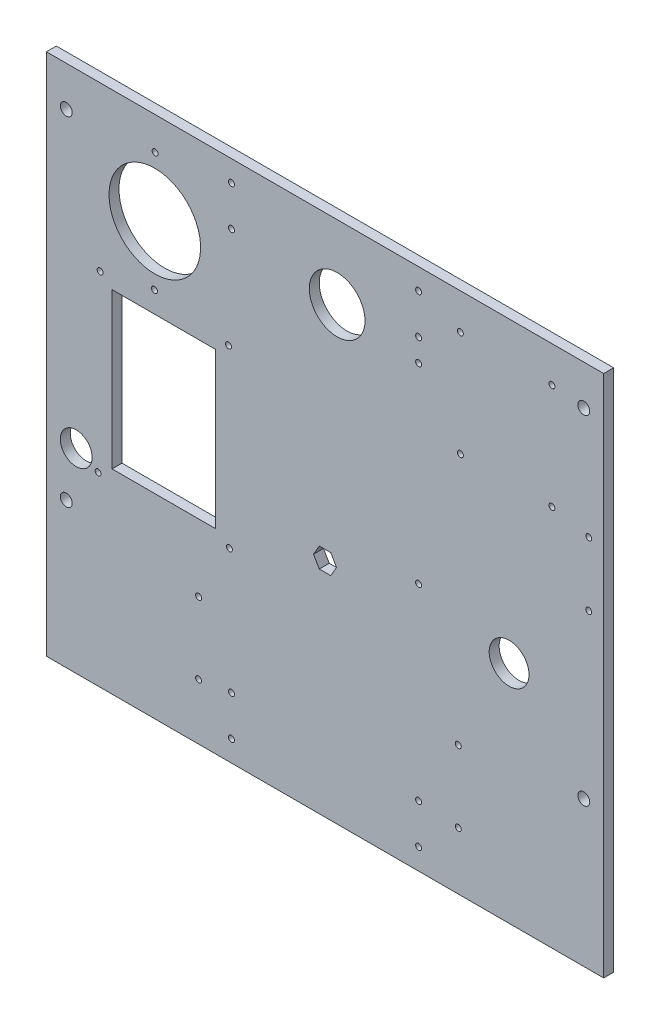
from build123d import *

# Parameters (mm, degrees)
ESQUISSE1_W              = 280
ESQUISSE1_H              = 210
BOSS_EXTRU_1_DEPTH       = 5
ESQUISSE2_R              = 3
ESQUISSE2_R_2            = 1.5
ESQUISSE2_R_3            = 8
ESQUISSE2_R_4            = 14
ESQUISSE2_R_5            = 10
ESQUISSE2_W              = 52
ESQUISSE2_H              = 78
ENL_V_MAT_EXTRU_1_DEPTH  = 351.035712464
ESQUISSE5_R              = 1.5
ENL_V_MAT_EXTRU_3_DEPTH  = 351.035712464
ESQUISSE6_W              = 280
ESQUISSE6_H              = 53
BOSS_EXTRU_4_DEPTH       = 5
ESQUISSE7_R              = 1.5
ENL_V_MAT_EXTRU_4_DEPTH  = 351.035712464
ESQUISSE8_R              = 1.5
ENL_V_MAT_EXTRU_5_DEPTH  = 351.035712464
ESQUISSE9_R              = 1.5
ENL_V_MAT_EXTRU_6_DEPTH  = 351.035712464
ESQUISSE14_R             = 23
ESQUISSE14_R_2           = 1.5
ENL_V_MAT_EXTRU_11_DEPTH = 351.035712464
ESQUISSE15_R             = 1.5
ENL_V_MAT_EXTRU_12_DEPTH = 351.035712464


with BuildPart() as part:
    # Esquisse1 → Boss.-Extru.1 (new body)
    with BuildSketch(Plane.XY):
        with Locations((140, 105)):
            Rectangle(ESQUISSE1_W, ESQUISSE1_H)
    extrude(amount=BOSS_EXTRU_1_DEPTH)

    # Esquisse2 → Enlèv. mat.-Extru.1 (cut, through all)
    with BuildSketch(Plane.XY):
        with Locations((270, 190)):
            Circle(ESQUISSE2_R)
        with Locations((10, 190)):
            Circle(ESQUISSE2_R)
        with Locations((10, 20)):
            Circle(ESQUISSE2_R)
        with Locations((270, 20)):
            Circle(ESQUISSE2_R)
        with Locations((187, 168)):
            Circle(ESQUISSE2_R_2)
        with Locations((187, 72)):
            Circle(ESQUISSE2_R_2)
        with Locations((91.5, 128)):
            Circle(ESQUISSE2_R_2)
        with Locations((27, 128)):
            Circle(ESQUISSE2_R_2)
        with Locations((92, 40)):
            Circle(ESQUISSE2_R_2)
        with Locations((26, 40)):
            Circle(ESQUISSE2_R_2)
        with Locations((15, 45)):
            Circle(ESQUISSE2_R_3)
        with Locations((146.093717203, 173)):
            Circle(ESQUISSE2_R_4)
        with Locations((232.477054828, 60.19739042)):
            Circle(ESQUISSE2_R_5)
        with Locations((272.5, 103)):
            Circle(ESQUISSE2_R_2)
        with Locations((272.5, 135)):
            Circle(ESQUISSE2_R_2)
        with Locations((59, 84)):
            Rectangle(ESQUISSE2_W, ESQUISSE2_H)
        Polygon((137.113248654, 63.5), (134.226497308, 58.5), (137.113248654, 53.5), (142.886751346, 53.5), (145.773502692, 58.5), (142.886751346, 63.5), align=None)
    extrude(amount=ENL_V_MAT_EXTRU_1_DEPTH, mode=Mode.SUBTRACT)

    # Esquisse5 → Enlèv. mat.-Extru.3 (cut, through all)
    with BuildSketch(Plane(origin=(0, 0, 0), x_dir=(-1, 0, 0), z_dir=(0, 0, -1))):
        with Locations((-93, 179.4)):
            Circle(ESQUISSE5_R)
        with Locations((-93, 199.4)):
            Circle(ESQUISSE5_R)
        with Locations((-187, 199.4)):
            Circle(ESQUISSE5_R)
        with Locations((-187, 179.4)):
            Circle(ESQUISSE5_R)
    extrude(amount=-ENL_V_MAT_EXTRU_3_DEPTH, mode=Mode.SUBTRACT)

    # Esquisse6 → Boss.-Extru.4 (add)
    with BuildSketch(Plane(origin=(0, 0, 0), x_dir=(-1, 0, 0), z_dir=(0, 0, -1))):
        with Locations((-140, -26.5)):
            Rectangle(ESQUISSE6_W, ESQUISSE6_H)
    extrude(amount=-BOSS_EXTRU_4_DEPTH)

    # Esquisse7 → Enlèv. mat.-Extru.4 (cut, through all)
    with BuildSketch(Plane(origin=(0, 0, 0), x_dir=(-1, 0, 0), z_dir=(0, 0, -1))):
        with Locations((-76.485302695, 11.149215752)):
            Circle(ESQUISSE7_R)
        with Locations((-76.473346209, -24.834750392)):
            Circle(ESQUISSE7_R)
    extrude(amount=-ENL_V_MAT_EXTRU_4_DEPTH, mode=Mode.SUBTRACT)

    # Esquisse8 → Enlèv. mat.-Extru.5 (cut, through all)
    with BuildSketch(Plane(origin=(0, 0, 0), x_dir=(-1, 0, 0), z_dir=(0, 0, -1))):
        with Locations((-206.944892865, -24.14)):
            Circle(ESQUISSE8_R)
        with Locations((-206.944892865, 11.843968131)):
            Circle(ESQUISSE8_R)
    extrude(amount=-ENL_V_MAT_EXTRU_5_DEPTH, mode=Mode.SUBTRACT)

    # Esquisse9 → Enlèv. mat.-Extru.6 (cut, through all)
    with BuildSketch(Plane(origin=(0, 0, 0), x_dir=(-1, 0, 0), z_dir=(0, 0, -1))):
        with Locations((-93, -22.4)):
            Circle(ESQUISSE9_R)
        with Locations((-93, -42.4)):
            Circle(ESQUISSE9_R)
        with Locations((-187, -42.4)):
            Circle(ESQUISSE9_R)
        with Locations((-187, -22.4)):
            Circle(ESQUISSE9_R)
    extrude(amount=-ENL_V_MAT_EXTRU_6_DEPTH, mode=Mode.SUBTRACT)

    # Esquisse14 → Enlèv. mat.-Extru.11 (cut, through all)
    with BuildSketch(Plane(origin=(0, 0, 0), x_dir=(-1, 0, 0), z_dir=(0, 0, -1))):
        with Locations((-54.48265068, 163.570126578)):
            Circle(ESQUISSE14_R)
        with Locations((-54.649127802, 193.569664664)):
            Circle(ESQUISSE14_R_2)
        with Locations((-54.316173557, 133.570588492)):
            Circle(ESQUISSE14_R_2)
    extrude(amount=-ENL_V_MAT_EXTRU_11_DEPTH, mode=Mode.SUBTRACT)

    # Esquisse15 → Enlèv. mat.-Extru.12 (cut, through all)
    with BuildSketch(Plane.XY.offset(5)):
        with Locations((254, 192)):
            Circle(ESQUISSE15_R)
        with Locations((208, 192)):
            Circle(ESQUISSE15_R)
        with Locations((208, 139)):
            Circle(ESQUISSE15_R)
        with Locations((254, 139)):
            Circle(ESQUISSE15_R)
    extrude(amount=-ENL_V_MAT_EXTRU_12_DEPTH, mode=Mode.SUBTRACT)


solid = part.part
